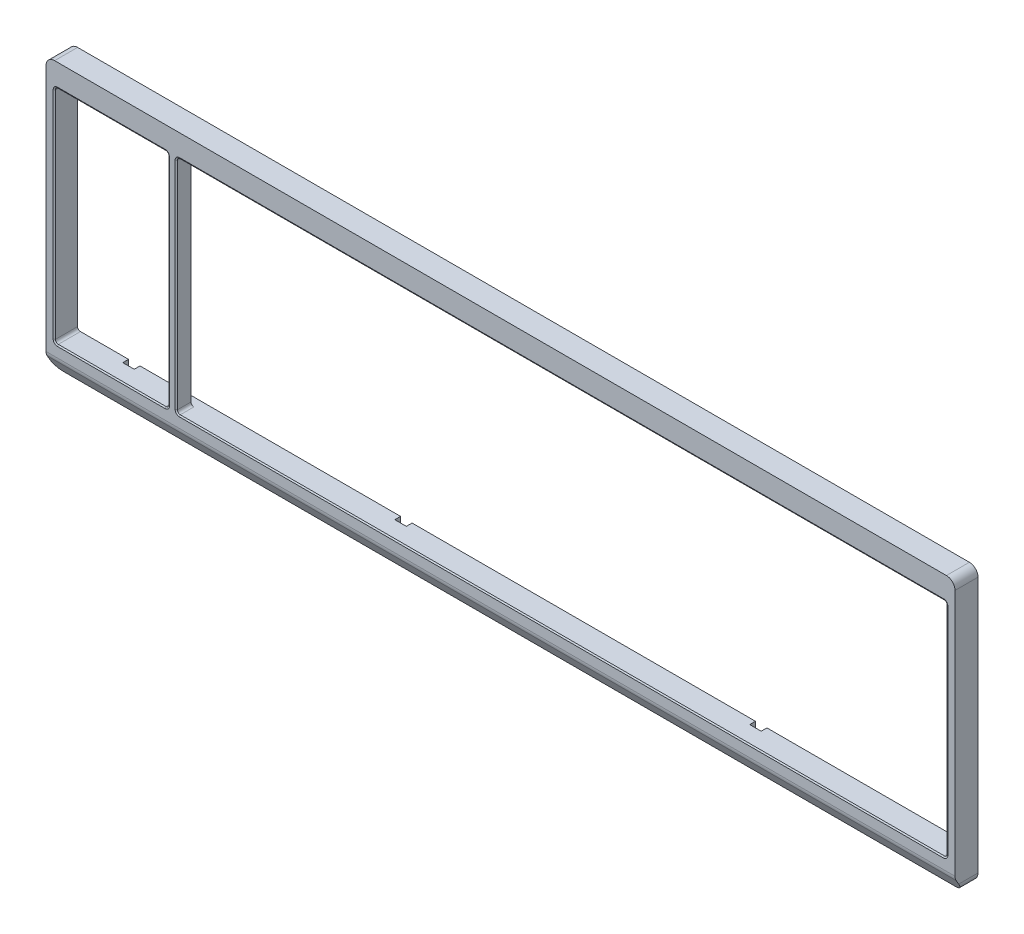
from build123d import *

# Parameters (mm, degrees)
SKETCH3_W                      = 316.5625
SKETCH3_H                      = 95.2
BOSS_EXTRUDE1_DEPTH            = 8
SKETCH3_3_W                    = 3
SKETCH3_3_H                    = 67.175
SKETCH3_3_H_2                  = 10.025
BOSS_EXTRUDE2_DEPTH            = 5
CHAMFER1_SIZE                  = 3
CHAMFER1_SIZE2                 = 5.196152423
FILLET3_R                      = 3
CUT_EXTRUDE1_DEPTH             = 2
FILLET1_R                      = 3
FILLET5_R                      = 1
CHAMFER2_SIZE                  = 0.5
CHAMFER2_SIZE2                 = 0.288675135
FILLET6_R                      = 0.5
CBORE_FOR_M2_SHCS2_D           = 2.4
CBORE_FOR_M2_SHCS2_DEPTH       = 12.278967257
CBORE_FOR_M2_SHCS2_CBORE_D     = 4.4
CBORE_FOR_M2_SHCS2_CBORE_DEPTH = 4
CBORE_FOR_M2_SHCS2_TIP         = 0.721032743
CBORE_FOR_M2_SHCS3_D           = 2.4
CBORE_FOR_M2_SHCS3_DEPTH       = 8.278967257
CBORE_FOR_M2_SHCS3_CBORE_D     = 4.4
CBORE_FOR_M2_SHCS3_CBORE_DEPTH = 3
CBORE_FOR_M2_SHCS3_TIP         = 0.721032743


with BuildPart() as part:
    # Sketch3 → Boss-Extrude1 (new body)
    with BuildSketch(Plane.XY):
        with Locations((154.78125, -39.1)):
            Rectangle(SKETCH3_W, SKETCH3_H)
        Polygon((38.98125, -76.7), (41.98125, -76.7), (310.0625, -76.7), (310.0625, 0.5), (41.98125, 0.5), (38.98125, 0.5), (-0.5, 0.5), (-0.5, -76.7), align=None, mode=Mode.SUBTRACT)
    extrude(amount=-BOSS_EXTRUDE1_DEPTH)

    # Sketch3<3> → Boss-Extrude2 (add)
    with BuildSketch(Plane.XY):
        with Locations((40.48125, -43.1125)):
            Rectangle(SKETCH3_3_W, SKETCH3_3_H)
        with Locations((40.48125, -4.5125)):
            Rectangle(SKETCH3_3_W, SKETCH3_3_H_2)
    extrude(amount=-BOSS_EXTRUDE2_DEPTH)

    # Chamfer1
    chamfer1_edges = [part.edges().sort_by_distance(p)[0] for p in [
        (154.78125, -86.7, 0),
    ]]
    chamfer1_side = [part.faces().sort_by_distance(p)[0] for p in [
        (154.78125, -86.7, -4),
    ]]
    chamfer(chamfer1_edges, length=CHAMFER1_SIZE, length2=CHAMFER1_SIZE2, reference=chamfer1_side[0])

    # Fillet3
    fillet3_edges = [part.edges().sort_by_distance(p)[0] for p in [
        (154.78125, -81.503847577, 0),
    ]]
    fillet(fillet3_edges, radius=FILLET3_R)

    # Sketch8 → Cut-Extrude1 (cut)
    with BuildSketch(Plane(origin=(0, 0, -8), x_dir=(-1, 0, 0), z_dir=(0, 0, -1))):
        with BuildLine():
            Line((-260.0625, 0.5), (-260.0625, 3.5))
            ThreePointArc((-260.0625, 3.5), (-259.623160172, 4.560660172), (-258.5625, 5))
            Line((-258.5625, 5), (-257.5625, 5))
            ThreePointArc((-257.5625, 5), (-256.501839828, 4.560660172), (-256.0625, 3.5))
            Line((-256.0625, 3.5), (-256.0625, 0.5))
            Line((-256.0625, 0.5), (-260.0625, 0.5))
        make_face()
        with BuildLine():
            Line((-115.98125, -76.7), (-115.98125, -79.7))
            ThreePointArc((-115.98125, -79.7), (-115.541910172, -80.760660172), (-114.48125, -81.2))
            Line((-114.48125, -81.2), (-113.48125, -81.2))
            ThreePointArc((-113.48125, -81.2), (-112.420589828, -80.760660172), (-111.98125, -79.7))
            Line((-111.98125, -79.7), (-111.98125, -76.7))
            Line((-111.98125, -76.7), (-115.98125, -76.7))
        make_face()
        with BuildLine():
            Line((-210.0625, 0.5), (-210.0625, 3.5))
            ThreePointArc((-210.0625, 3.5), (-209.623160172, 4.560660172), (-208.5625, 5))
            Line((-208.5625, 5), (-207.5625, 5))
            ThreePointArc((-207.5625, 5), (-206.501839828, 4.560660172), (-206.0625, 3.5))
            Line((-206.0625, 3.5), (-206.0625, 0.5))
            Line((-206.0625, 0.5), (-210.0625, 0.5))
        make_face()
        with BuildLine():
            Line((-145.98125, 0.5), (-145.98125, 3.5))
            ThreePointArc((-145.98125, 3.5), (-145.541910172, 4.560660172), (-144.48125, 5))
            Line((-144.48125, 5), (-143.48125, 5))
            ThreePointArc((-143.48125, 5), (-142.420589828, 4.560660172), (-141.98125, 3.5))
            Line((-141.98125, 3.5), (-141.98125, 0.5))
            Line((-141.98125, 0.5), (-145.98125, 0.5))
        make_face()
        with BuildLine():
            Line((-95.98125, 0.5), (-95.98125, 3.5))
            ThreePointArc((-95.98125, 3.5), (-95.541910172, 4.560660172), (-94.48125, 5))
            Line((-94.48125, 5), (-93.48125, 5))
            ThreePointArc((-93.48125, 5), (-92.420589828, 4.560660172), (-91.98125, 3.5))
            Line((-91.98125, 3.5), (-91.98125, 0.5))
            Line((-91.98125, 0.5), (-95.98125, 0.5))
        make_face()
        with BuildLine():
            Line((-21.240625, 0.5), (-21.240625, 3.5))
            ThreePointArc((-21.240625, 3.5), (-20.801285172, 4.560660172), (-19.740625, 5))
            Line((-19.740625, 5), (-18.740625, 5))
            ThreePointArc((-18.740625, 5), (-17.679964828, 4.560660172), (-17.240625, 3.5))
            Line((-17.240625, 3.5), (-17.240625, 0.5))
            Line((-17.240625, 0.5), (-21.240625, 0.5))
        make_face()
        with BuildLine():
            Line((-239.5625, -76.7), (-239.5625, -79.7))
            ThreePointArc((-239.5625, -79.7), (-239.123160172, -80.760660172), (-238.0625, -81.2))
            Line((-238.0625, -81.2), (-237.0625, -81.2))
            ThreePointArc((-237.0625, -81.2), (-236.001839828, -80.760660172), (-235.5625, -79.7))
            Line((-235.5625, -79.7), (-235.5625, -76.7))
            Line((-235.5625, -76.7), (-239.5625, -76.7))
        make_face()
        with BuildLine():
            Line((-21.240625, -76.7), (-21.240625, -79.7))
            ThreePointArc((-21.240625, -79.7), (-20.801285172, -80.760660172), (-19.740625, -81.2))
            Line((-19.740625, -81.2), (-18.740625, -81.2))
            ThreePointArc((-18.740625, -81.2), (-17.679964828, -80.760660172), (-17.240625, -79.7))
            Line((-17.240625, -79.7), (-17.240625, -76.7))
            Line((-17.240625, -76.7), (-21.240625, -76.7))
        make_face()
    extrude(amount=-CUT_EXTRUDE1_DEPTH, mode=Mode.SUBTRACT)

    # Fillet1
    fillet1_edges = [part.edges().sort_by_distance(p)[0] for p in [
        (313.0625, -86.7, -5.5),
        (-3.5, -86.7, -5.5),
        (-3.5, 8.5, -4),
        (313.0625, 8.5, -4),
    ]]
    fillet(fillet1_edges, radius=FILLET1_R)

    # Fillet5
    fillet5_edges = [part.edges().sort_by_distance(p)[0] for p in [
        (310.0625, -76.7, -4),
        (310.0625, 0.5, -4),
        (-0.5, 0.5, -4),
        (-0.5, -76.7, -4),
        (41.98125, 0.5, -2.5),
        (41.98125, -76.7, -2.5),
        (38.98125, -76.7, -2.5),
        (38.98125, 0.5, -2.5),
    ]]
    fillet(fillet5_edges, radius=FILLET5_R)

    # Chamfer2
    chamfer2_edges = [part.edges().sort_by_distance(p)[0] for p in [
        (310.0625, -38.1, 0),
        (19.240625, -76.7, 0),
        (176.021875, -76.7, 0),
        (176.021875, 0.5, 0),
        (19.240625, 0.5, 0),
        (41.98125, -38.1, 0),
        (38.98125, -38.1, 0),
        (-0.5, -38.1, 0),
        (309.769606781, -76.407106781, 0),
        (309.769606781, 0.207106781, 0),
        (42.274143219, 0.207106781, 0),
        (42.274143219, -76.407106781, 0),
        (38.688356781, -76.407106781, 0),
        (-0.207106781, -76.407106781, 0),
        (-0.207106781, 0.207106781, 0),
        (38.688356781, 0.207106781, 0),
    ]]
    chamfer2_side = [part.faces().sort_by_distance(p)[0] for p in [
        (310.391389733, -38.1, 0),
    ]]
    chamfer(chamfer2_edges, length=CHAMFER2_SIZE, length2=CHAMFER2_SIZE2, reference=chamfer2_side[0])

    # Fillet6
    fillet6_edges = [part.edges().sort_by_distance(p)[0] for p in [
        (256.0625, 0.5, -7),
        (260.0625, 0.5, -7),
    ]]
    fillet(fillet6_edges, radius=FILLET6_R)

    # CBORE for M2 SHCS2
    with Locations(Plane(origin=(0, -0.720708302, -17.082674747), x_dir=(-1, 0, 0), z_dir=(0, 0, -1))):
        with Locations((-304.78125, 3.743540113), (-4.78125, 3.743540113)):
            CounterBoreHole(CBORE_FOR_M2_SHCS2_D / 2, CBORE_FOR_M2_SHCS2_CBORE_D / 2, CBORE_FOR_M2_SHCS2_CBORE_DEPTH, depth=CBORE_FOR_M2_SHCS2_DEPTH)
            with Locations((0, 0, -(CBORE_FOR_M2_SHCS2_DEPTH + CBORE_FOR_M2_SHCS2_TIP / 2))):  # 118° drill point
                Cone(0, CBORE_FOR_M2_SHCS2_D / 2, CBORE_FOR_M2_SHCS2_TIP, mode=Mode.SUBTRACT)

    # CBORE for M2 SHCS3
    with Locations(Plane(origin=(0, 0, -9.799622892), x_dir=(1, 0, 0), z_dir=(0, 0, -1))):
        with Locations((4.78125, 80.87420884), (304.78125, 80.87420884)):
            CounterBoreHole(CBORE_FOR_M2_SHCS3_D / 2, CBORE_FOR_M2_SHCS3_CBORE_D / 2, CBORE_FOR_M2_SHCS3_CBORE_DEPTH, depth=CBORE_FOR_M2_SHCS3_DEPTH)
            with Locations((0, 0, -(CBORE_FOR_M2_SHCS3_DEPTH + CBORE_FOR_M2_SHCS3_TIP / 2))):  # 118° drill point
                Cone(0, CBORE_FOR_M2_SHCS3_D / 2, CBORE_FOR_M2_SHCS3_TIP, mode=Mode.SUBTRACT)


solid = part.part
